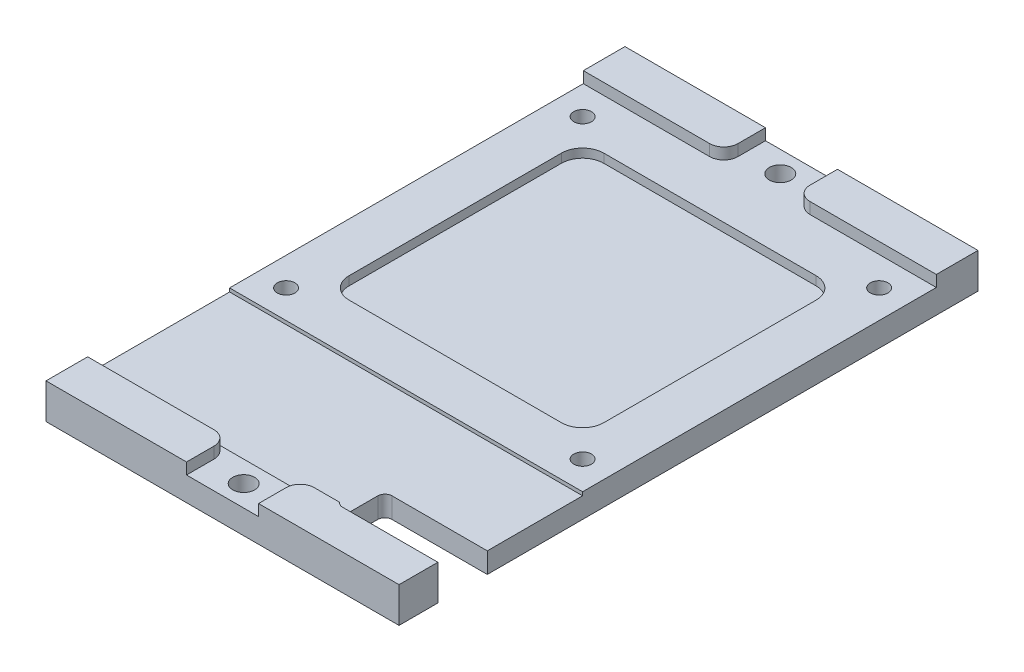
from build123d import *

# Parameters (mm, degrees)
SKETCH_202_W           = 50
SKETCH_202_H           = 82
EXTRUDE_1_DEPTH        = 3.4
SKETCH_2_W             = 36.07
SKETCH_2_H             = 36.07
ADR1399KEZ_DEPTH       = 1.25
SKETCH_3_R             = 1.25
SKETCH_3_R_2           = 1.55
CUT_EXTRUDE_963_DEPTH  = 57.899560631
SKETCH_5_W             = 50
SKETCH_5_H             = 20
CUT_EXTRUDE_1417_DEPTH = 0.5
FILLET_1474_R          = 3
SKETCH_9_W             = 19.9
SKETCH_9_H             = 5.9
EXTRUDE_2_DEPTH        = 1.6
SKETCH_7_W             = 14.5
SKETCH_7_H             = 7
CUT_EXTRUDE_7_DEPTH    = 58.017541161
FILLET_3_R             = 1
FILLET_4_R             = 2


with BuildPart() as part:
    # Sketch 202 → Бобышка-Вытянуть1 (new body)
    with BuildSketch(Plane(origin=(0, 0, 0), x_dir=(1, 0, 0), z_dir=(0, 1, 0))):
        with Locations((0, -10)):
            Rectangle(SKETCH_202_W, SKETCH_202_H)
    extrude(amount=EXTRUDE_1_DEPTH)

    # Эскиз2 → Выемка для ADR1399KEZ (cut)
    with BuildSketch(Plane(origin=(0, 3.4, 0), x_dir=(1, 0, 0), z_dir=(0, 1, 0))):
        Rectangle(SKETCH_2_W, SKETCH_2_H)
    extrude(amount=-ADR1399KEZ_DEPTH, mode=Mode.SUBTRACT)

    # Эскиз3 → Cut-Extrude 963 (cut, through all)
    with BuildSketch(Plane(origin=(0, 0, 0), x_dir=(1, 0, 0), z_dir=(0, 1, 0))):
        with Locations(Location((-21, 21, 0), (0, 0, 90))):
            Circle(SKETCH_3_R)
        with Locations(Location((21, 21, 0), (0, 0, 90))):
            Circle(SKETCH_3_R)
        with Locations(Location((-21, -21, 0), (0, 0, 90))):
            Circle(SKETCH_3_R)
        with Locations(Location((21, -21, 0), (0, 0, 90))):
            Circle(SKETCH_3_R)
        with Locations(Location((0, 28, 0), (0, 0, 90))):
            Circle(SKETCH_3_R_2)
        with Locations(Location((0, -48, 0), (0, 0, 90))):
            Circle(SKETCH_3_R_2)
    extrude(amount=CUT_EXTRUDE_963_DEPTH, mode=Mode.SUBTRACT)

    # Эскиз5 → Cut-Extrude 1417 (cut)
    with BuildSketch(Plane(origin=(0, 3.4, 0), x_dir=(1, 0, 0), z_dir=(0, 1, 0))):
        with Locations((0, -35)):
            Rectangle(SKETCH_5_W, SKETCH_5_H)
    extrude(amount=-CUT_EXTRUDE_1417_DEPTH, mode=Mode.SUBTRACT)

    # Fillet 1474
    fillet_1474_edges = [part.edges().sort_by_distance(p)[0] for p in [
        (18.035, 2.775, -18.035),
        (18.035, 2.775, 18.035),
        (-18.035, 2.775, 18.035),
        (-18.035, 2.775, -18.035),
    ]]
    fillet(fillet_1474_edges, radius=FILLET_1474_R)

    # Эскиз9 → Бобышка-Вытянуть2 (add)
    with BuildSketch(Plane(origin=(0, 3.4, 0), x_dir=(1, 0, 0), z_dir=(0, 1, 0))):
        with Locations((-15.05, 28.05)):
            Rectangle(SKETCH_9_W, SKETCH_9_H)
        with Locations((15.05, 28.05)):
            Rectangle(SKETCH_9_W, SKETCH_9_H)
        with Locations((-15.05, -48.05)):
            Rectangle(SKETCH_9_W, SKETCH_9_H)
        with Locations((15.05, -48.05)):
            Rectangle(SKETCH_9_W, SKETCH_9_H)
    extrude(amount=EXTRUDE_2_DEPTH)

    # Эскиз7 → Вырез-Вытянуть7 (cut, through all)
    with BuildSketch(Plane.XZ):
        with Locations((17.75, 42)):
            Rectangle(SKETCH_7_W, SKETCH_7_H)
    extrude(amount=-CUT_EXTRUDE_7_DEPTH, mode=Mode.SUBTRACT)

    # Скругление3
    fillet_3_edges = [part.edges().sort_by_distance(p)[0] for p in [
        (10.5, 1.45, 38.5),
        (10.5, 2.5, 45.5),
    ]]
    fillet(fillet_3_edges, radius=FILLET_3_R)

    # Скругление4
    fillet_4_edges = [part.edges().sort_by_distance(p)[0] for p in [
        (5.1, 4.2, -25.1),
        (-5.1, 4.2, 45.1),
        (5.1, 4.2, 45.1),
        (-5.1, 4.2, -25.1),
    ]]
    fillet(fillet_4_edges, radius=FILLET_4_R)


solid = part.part
